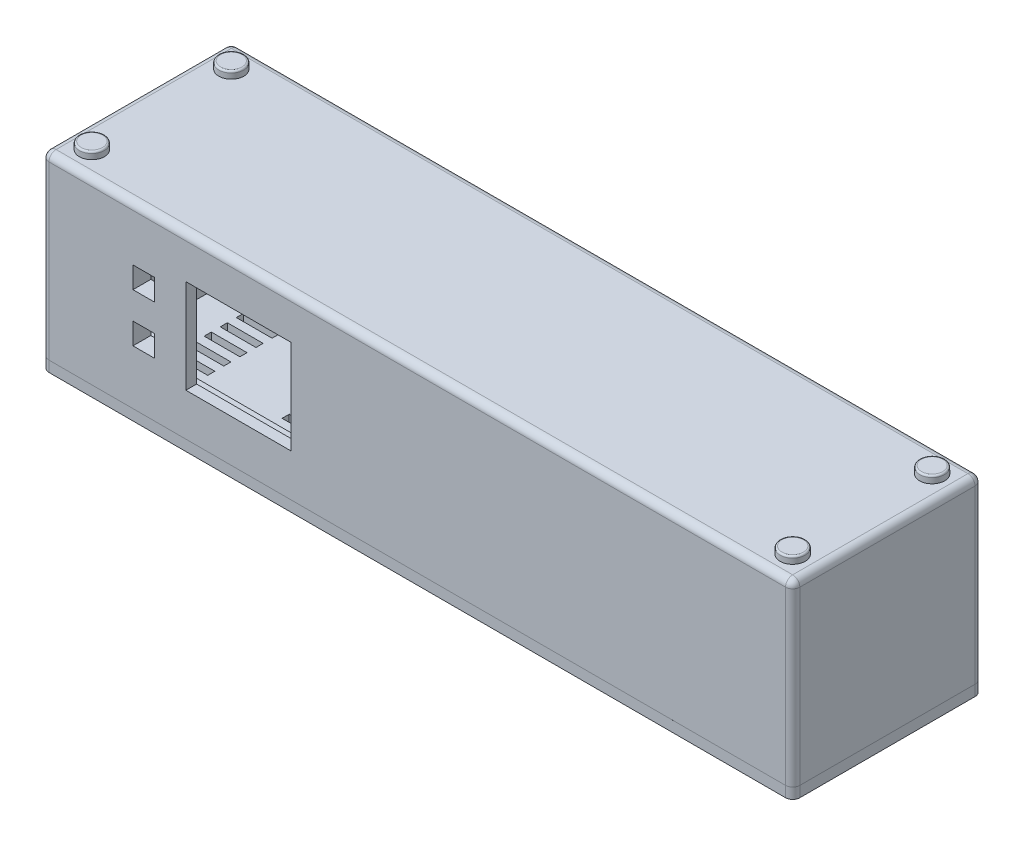
from build123d import *

# Parameters (mm, degrees)
SKETCH_232_W           = 210
SKETCH_232_H           = 53
EXTRUDE_1_DEPTH        = 50
SKETCH_3_W             = 200
SKETCH_3_H             = 43
CUT_EXTRUDE_1_DEPTH    = 45
SKETCH_4_R             = 3.5
EXTRUDE_2_DEPTH        = 2
EXTRUDE_2_TAPER        = 1
FILLET_2_R             = 0.5
SKETCH_4_5_R           = 3.5
EXTRUDE_3_DEPTH        = 2
SKETCH_4_6_R           = 3.5
EXTRUDE_4_DEPTH        = 2
SKETCH_4_7_R           = 3.5
EXTRUDE_5_DEPTH        = 2
FILLET_3_R             = 0.5
FILLET_4_R             = 0.5
FILLET_5_R             = 0.5
SKETCH_7_R             = 6
CUT_EXTRUDE_2_DEPTH    = 14
CUT_EXTRUDE_2_DRAFT    = -5
FILLET_6_R             = 2
SKETCH_8_R             = 7
EXTRUDE_6_DEPTH        = 7
EXTRUDE_6_TAPER        = 5
SKETCH_9_R             = 5.15
CUT_EXTRUDE_3_DEPTH    = 7
CUT_EXTRUDE_3_DRAFT    = 5
SKETCH_10_W            = 29.4
SKETCH_10_H            = 26.3
CUT_EXTRUDE_4_DEPTH    = 5
SKETCH_13_W            = 39.2
SKETCH_13_H            = 27.5
CUT_EXTRUDE_5_DEPTH    = 2
SKETCH_14_W            = 6
SKETCH_14_H            = 6
CUT_EXTRUDE_6_DEPTH    = 5
FILLET_7_R             = 2
EXTRUDE_8_DEPTH        = 3
SKETCH_18_W            = 200
SKETCH_18_H            = 43
SKETCH_18_W_2          = 194
SKETCH_18_H_2          = 37
EXTRUDE_4669_DEPTH     = 3
SKETCH_21_W            = 10
SKETCH_21_H            = 2
CUT_EXTRUDE_12_DEPTH   = 5
PATTERN_LINEAR_1_COUNT = 10
PATTERN_LINEAR_1_PITCH = 4.5


with BuildPart() as part:
    # Sketch 232 → Бобышка-Вытянуть1 (new body)
    with BuildSketch(Plane(origin=(0, 0, 0), x_dir=(1, 0, 0), z_dir=(0, 1, 0))):
        Rectangle(SKETCH_232_W, SKETCH_232_H)
    extrude(amount=EXTRUDE_1_DEPTH)

    # Эскиз3 → Вырез-Вытянуть1 (cut)
    with BuildSketch(Plane.XZ):
        Rectangle(SKETCH_3_W, SKETCH_3_H)
    extrude(amount=-CUT_EXTRUDE_1_DEPTH, mode=Mode.SUBTRACT)

    # Эскиз4 → Бобышка-Вытянуть2 (add)
    with BuildSketch(Plane(origin=(0, 50, 0), x_dir=(1, 0, 0), z_dir=(0, 1, 0))):
        with Locations((98, 19.5)):
            Circle(SKETCH_4_R)
    extrude(amount=EXTRUDE_2_DEPTH, taper=EXTRUDE_2_TAPER)

    # Скругление2
    fillet_2_edges = [part.edges().sort_by_distance(p)[0] for p in [
        (94.53491013, 52, -19.5),
    ]]
    fillet(fillet_2_edges, radius=FILLET_2_R)

    # Эскиз4<5> → Бобышка-Вытянуть3 (add)
    with BuildSketch(Plane(origin=(0, 50, 0), x_dir=(1, 0, 0), z_dir=(0, 1, 0))):
        with Locations(Location((98, -19.5, 0), (0, 0, 90))):
            Circle(SKETCH_4_5_R)
    extrude(amount=EXTRUDE_3_DEPTH)

    # Эскиз4<6> → Бобышка-Вытянуть4 (add)
    with BuildSketch(Plane(origin=(0, 50, 0), x_dir=(1, 0, 0), z_dir=(0, 1, 0))):
        with Locations(Location((-98, -19.5, 0), (0, 0, 270))):
            Circle(SKETCH_4_6_R)
    extrude(amount=EXTRUDE_4_DEPTH)

    # Эскиз4<7> → Бобышка-Вытянуть5 (add)
    with BuildSketch(Plane(origin=(0, 50, 0), x_dir=(1, 0, 0), z_dir=(0, 1, 0))):
        with Locations(Location((-98, 19.5, 0), (0, 0, 90))):
            Circle(SKETCH_4_7_R)
    extrude(amount=EXTRUDE_5_DEPTH)

    # Скругление3
    fillet_3_edges = [part.edges().sort_by_distance(p)[0] for p in [
        (-98, 52, 16),
    ]]
    fillet(fillet_3_edges, radius=FILLET_3_R)

    # Скругление4
    fillet_4_edges = [part.edges().sort_by_distance(p)[0] for p in [
        (-98, 52, -16),
    ]]
    fillet(fillet_4_edges, radius=FILLET_4_R)

    # Скругление5
    fillet_5_edges = [part.edges().sort_by_distance(p)[0] for p in [
        (98, 52, 23),
    ]]
    fillet(fillet_5_edges, radius=FILLET_5_R)


with BuildPart() as cut_extrude_2_tool:
    # Эскиз7 → Вырез-Вытянуть2 (with draft: the straight prism first)
    with BuildSketch(Plane(origin=(0, 0, -26.5), x_dir=(-1, 0, 0), z_dir=(0, 0, -1))):
        with Locations((0, 35.081888724)):
            Circle(SKETCH_7_R)
    extrude(amount=-CUT_EXTRUDE_2_DEPTH)
    # Вырез-Вытянуть2: the draft: its side faces are tilted about the plane it starts from
    cut_extrude_2_sides = [cut_extrude_2_tool.faces().sort_by_distance(p)[0] for p in [
        (6, 35.081888724, -19.5),
    ]]
    draft(cut_extrude_2_sides, Plane(origin=(0, 0, -26.5), x_dir=(-1, 0, 0), z_dir=(0, 0, -1)), CUT_EXTRUDE_2_DRAFT)


with BuildPart() as part_1:
    add(part.part)

    # Вырез-Вытянуть2: cut by cut_extrude_2_tool
    add(cut_extrude_2_tool.part, mode=Mode.SUBTRACT)

    # Скругление6
    fillet_6_edges = [part_1.edges().sort_by_distance(p)[0] for p in [
        (6, 35.081888724, -26.5),
    ]]
    fillet(fillet_6_edges, radius=FILLET_6_R)

    # Эскиз8 → Бобышка-Вытянуть6 (add)
    with BuildSketch(Plane.XY.offset(-21.5)):
        with Locations((0, 35.081888724)):
            Circle(SKETCH_8_R)
    extrude(amount=EXTRUDE_6_DEPTH, taper=EXTRUDE_6_TAPER)


with BuildPart() as cut_extrude_3_tool:
    # Эскиз9 → Вырез-Вытянуть3 (with draft: the straight prism first)
    with BuildSketch(Plane.XY.offset(-14.5)):
        with Locations((0, 35.081888724)):
            Circle(SKETCH_9_R)
    extrude(amount=-CUT_EXTRUDE_3_DEPTH)
    # Вырез-Вытянуть3: the draft: its side faces are tilted about the plane it starts from
    cut_extrude_3_sides = [cut_extrude_3_tool.faces().sort_by_distance(p)[0] for p in [
        (-5.15, 35.081888724, -18),
    ]]
    draft(cut_extrude_3_sides, Plane.XY.offset(-14.5), CUT_EXTRUDE_3_DRAFT)


with BuildPart() as part_2:
    add(part_1.part)

    # Вырез-Вытянуть3: cut by cut_extrude_3_tool
    add(cut_extrude_3_tool.part, mode=Mode.SUBTRACT)

    # Эскиз10 → Вырез-Вытянуть4 (cut)
    with BuildSketch(Plane.XY.offset(26.5)):
        with Locations((-50, 25)):
            Rectangle(SKETCH_10_W, SKETCH_10_H)
    extrude(amount=-CUT_EXTRUDE_4_DEPTH, mode=Mode.SUBTRACT)

    # Эскиз13 → Вырез-Вытянуть5 (cut)
    with BuildSketch(Plane(origin=(0, 0, 21.5), x_dir=(-1, 0, 0), z_dir=(0, 0, -1))):
        with Locations((50, 25)):
            Rectangle(SKETCH_13_W, SKETCH_13_H)
    extrude(amount=-CUT_EXTRUDE_5_DEPTH, mode=Mode.SUBTRACT)

    # Эскиз14 → Вырез-Вытянуть6 (cut)
    with BuildSketch(Plane.XY.offset(26.5)):
        with Locations((-76.5, 31.8)):
            Rectangle(SKETCH_14_W, SKETCH_14_H)
        with Locations((-76.5, 18.2)):
            Rectangle(SKETCH_14_W, SKETCH_14_H)
    extrude(amount=-CUT_EXTRUDE_6_DEPTH, mode=Mode.SUBTRACT)

    # Скругление7
    fillet_7_edges = [part_2.edges().sort_by_distance(p)[0] for p in [
        (-105, 50, 0),
        (0, 50, 26.5),
        (105, 50, 0),
        (105, 25, 26.5),
        (-105, 25, 26.5),
        (-105, 25, -26.5),
        (105, 25, -26.5),
        (0, 50, -26.5),
    ]]
    fillet(fillet_7_edges, radius=FILLET_7_R)


with BuildPart() as body_2:
    # Эскиз17 → Бобышка-Вытянуть8 (new body)
    with BuildSketch(Plane.XZ):
        with BuildLine():
            Line((-105, 24.5), (-105, -24.5))
            ThreePointArc((-105, -24.5), (-104.414213562, -25.914213562), (-103, -26.5))
            Line((-103, -26.5), (103, -26.5))
            ThreePointArc((103, -26.5), (104.414213562, -25.914213562), (105, -24.5))
            Line((105, -24.5), (105, 24.5))
            ThreePointArc((105, 24.5), (104.414213562, 25.914213562), (103, 26.5))
            Line((103, 26.5), (-103, 26.5))
            ThreePointArc((-103, 26.5), (-104.414213562, 25.914213562), (-105, 24.5))
        make_face()
    extrude(amount=EXTRUDE_8_DEPTH)

    # Эскиз18 → Extrude 4669 (add)
    with BuildSketch(Plane(origin=(0, 0, 0), x_dir=(1, 0, 0), z_dir=(0, 1, 0))):
        Rectangle(SKETCH_18_W, SKETCH_18_H)
        Rectangle(SKETCH_18_W_2, SKETCH_18_H_2, mode=Mode.SUBTRACT)
    extrude(amount=EXTRUDE_4669_DEPTH)

    # Эскиз21 → Вырез-Вытянуть12 (cut)
    with BuildSketch(Plane.XZ.offset(3)):
        with Locations((15.5, 20.5)):
            Rectangle(SKETCH_21_W, SKETCH_21_H)
        with Locations((-15.5, 20.5)):
            Rectangle(SKETCH_21_W, SKETCH_21_H)
        with Locations((-51.3, 20.5)):
            Rectangle(SKETCH_21_W, SKETCH_21_H)
        with Locations((-82.1, 20.5)):
            Rectangle(SKETCH_21_W, SKETCH_21_H)
        with Locations((82.3, 20.5)):
            Rectangle(SKETCH_21_W, SKETCH_21_H)
        with Locations((51.3, 20.5)):
            Rectangle(SKETCH_21_W, SKETCH_21_H)
    cut_extrude_12 = extrude(amount=-CUT_EXTRUDE_12_DEPTH, mode=Mode.SUBTRACT)

    # Линейный массив1: Вырез-Вытянуть12 ×10
    with Locations(*[(0, 0, -i * PATTERN_LINEAR_1_PITCH) for i in range(1, PATTERN_LINEAR_1_COUNT)]):
        add(cut_extrude_12, mode=Mode.SUBTRACT)


solid = Compound([part_2.part, body_2.part])
